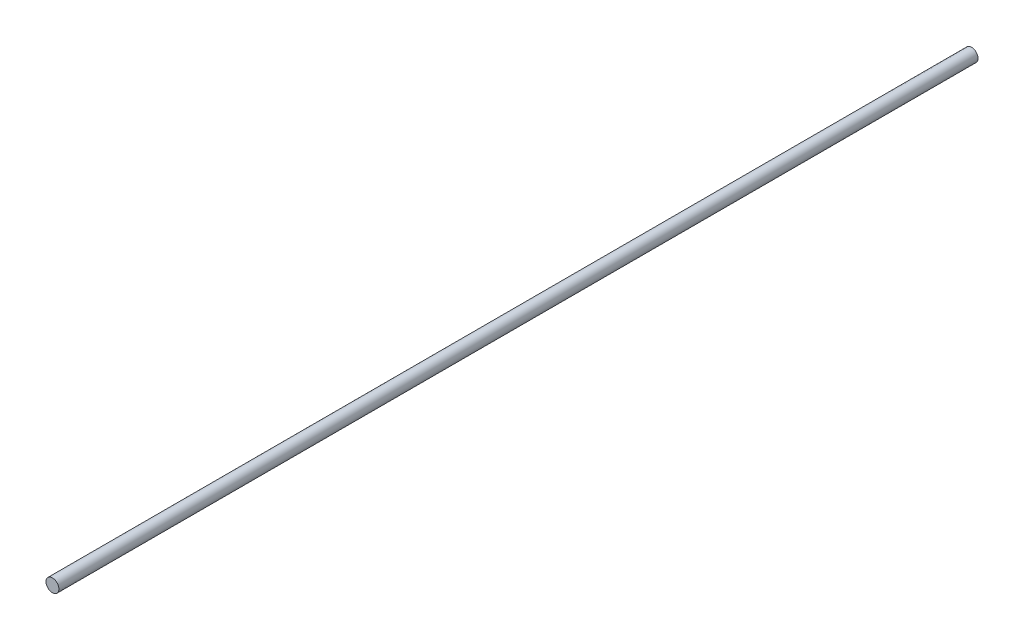
from build123d import *

# Parameters (mm, degrees)
SKIZZE1_R                       = 4
AUFSATZ_LINEAR_AUSTRAGEN1_DEPTH = 570


with BuildPart() as part:
    # Skizze1 → Aufsatz-Linear austragen1 (new body)
    with BuildSketch(Plane.XY):
        Circle(SKIZZE1_R)
    extrude(amount=AUFSATZ_LINEAR_AUSTRAGEN1_DEPTH)


solid = part.part
